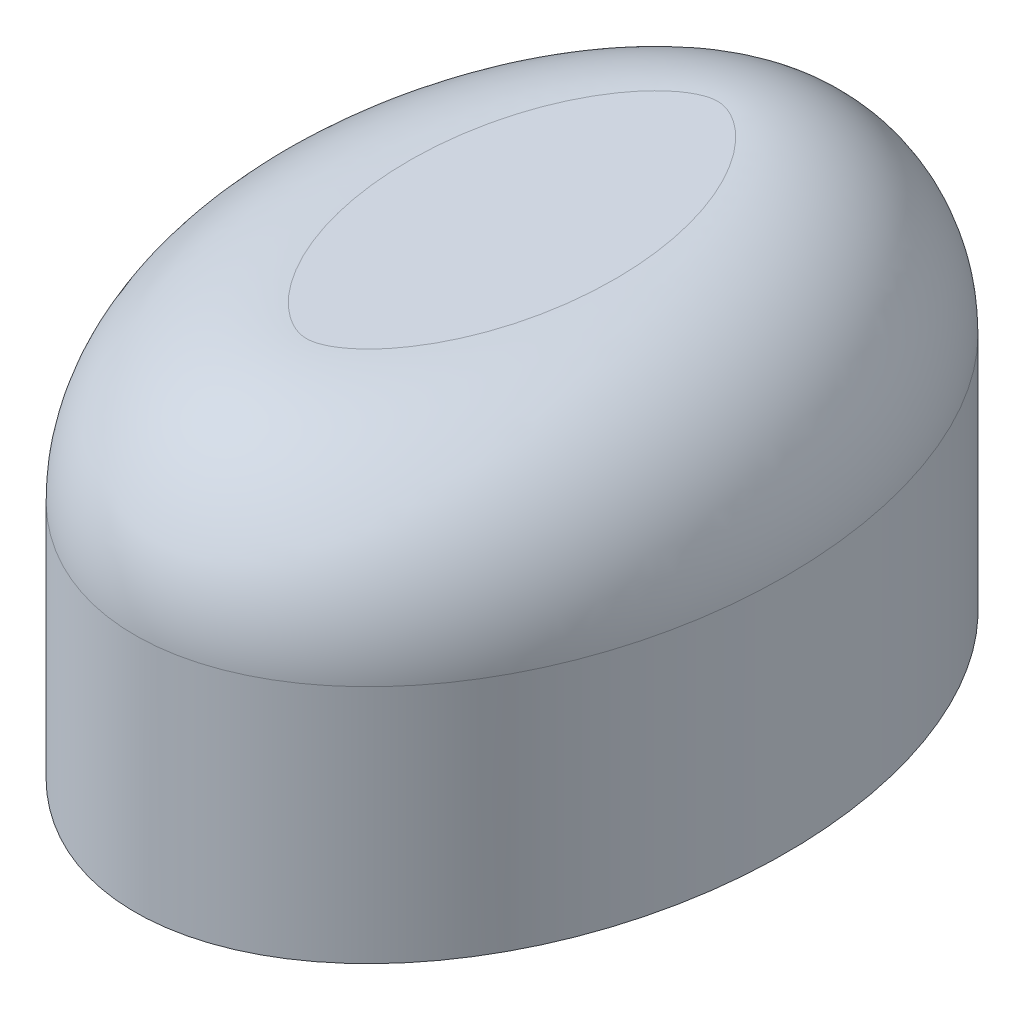
from build123d import *

# Parameters (mm, degrees)
SKETCH1_RX          = 2.75
SKETCH1_RY          = 2
BOSS_EXTRUDE1_DEPTH = 3
FILLET1_R           = 1.25


with BuildPart() as part:
    # Sketch1 → Boss-Extrude1 (new body)
    with BuildSketch(Plane(origin=(0, 0, 0), x_dir=(1, 0, 0), z_dir=(0, 1, 0))):
        with Locations(Location((0, 0), (0, 0, 90))):
            Ellipse(SKETCH1_RX, SKETCH1_RY)
    extrude(amount=BOSS_EXTRUDE1_DEPTH)

    # Fillet1
    fillet1_edges = [part.edges().sort_by_distance(p)[0] for p in [
        (0.000970351, 3, 2.749999676),
    ]]
    fillet(fillet1_edges, radius=FILLET1_R)


solid = part.part
